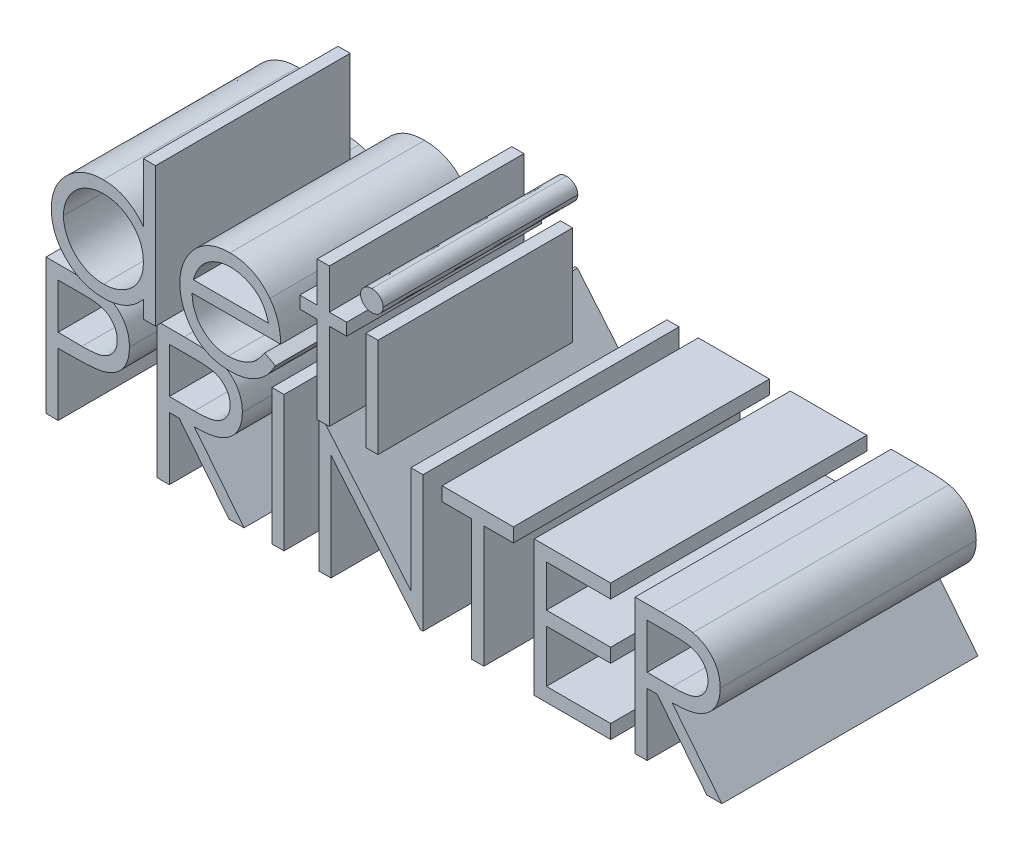
from build123d import *

# Parameters (mm, degrees)
BOSS_EXTRUDE1_DEPTH      = 50
BOSS_EXTRUDE1_2_DEPTH    = 50
SKETCH1_W                = 2.374465812
SKETCH1_H                = 26.458333333
BOSS_EXTRUDE1_3_DEPTH    = 50
BOSS_EXTRUDE1_4_DEPTH    = 50
BOSS_EXTRUDE1_5_DEPTH    = 50
BOSS_EXTRUDE1_6_DEPTH    = 50
BOSS_EXTRUDE1_7_DEPTH    = 50
BOSS_EXTRUDE2_DEPTH      = 1
BOSS_EXTRUDE2_DEPTH_BACK = 37
SKETCH2_W                = 2.374465812
SKETCH2_H                = 19.334935898


with BuildPart() as part:
    # Sketch1 → Boss-Extrude1 (new body)
    with BuildSketch(Plane.XY):
        with BuildLine():
            Line((3.392094017, 26.458333333), (8.580937834, 26.458333333))
            add(Edge.make_bspline(
                [(8.580937834, 26.458333333), (8.937829803, 26.457941022), (9.621650665, 26.457189337), (10.602234717, 26.434399295), (11.492820189, 26.40395942), (12.291486759, 26.361762965), (13.000691786, 26.311895884), (13.617226134, 26.241954872), (14.145935875, 26.168927638), (14.462728677, 26.094682482), (14.607204861, 26.060822316)],
                knots=[0, 0, 0, 0, 1.415646017, 2.712440637, 3.8905458, 4.950247383, 5.884950622, 6.709939814, 7.411656543, 8, 8, 8, 8], degree=3))
            add(Edge.make_bspline(
                [(14.607204861, 26.060822316), (14.790096456, 26.010763528), (15.151570034, 25.911825526), (15.672429109, 25.713662259), (16.167984965, 25.478695892), (16.639937818, 25.210907775), (17.082488088, 24.89880857), (17.502238517, 24.555049674), (17.895484797, 24.171694363), (18.260015557, 23.753042342), (18.594787539, 23.306121708), (18.883029783, 22.824260803), (19.124384416, 22.315570593), (19.331388909, 21.780404906), (19.48037544, 21.214269722), (19.592610931, 20.621098742), (19.663849069, 20.000955548), (19.670672006, 19.577169645), (19.674145299, 19.361436632)],
                knots=[0, 0, 0, 0, 0.999701418, 1.975846123, 2.934577507, 3.890451536, 4.834027766, 5.787354733, 6.749476667, 7.726910423, 8.712836071, 9.690891519, 10.682875813, 11.679750201, 12.712814741, 13.765529915, 14.8625177, 16, 16, 16, 16], degree=3))
            add(Edge.make_bspline(
                [(19.674145299, 19.361436632), (19.670959529, 19.143890343), (19.664726354, 18.718246336), (19.58991515, 18.095547282), (19.489145249, 17.500473738), (19.334197294, 16.934345154), (19.131256789, 16.400523556), (18.893191865, 15.890851147), (18.606054463, 15.413998865), (18.276120334, 14.968235536), (17.9090934, 14.553142747), (17.506526546, 14.171728527), (17.07004499, 13.826225492), (16.601035894, 13.515859085), (16.094926918, 13.247826495), (15.559393971, 13.007756393), (14.989782216, 12.806135875), (14.59560964, 12.700075291), (14.395198985, 12.646150507)],
                knots=[0, 0, 0, 0, 1.121902311, 2.195077645, 3.232258892, 4.234102512, 5.217864754, 6.176164875, 7.132989551, 8.084763148, 9.034132444, 9.988522005, 10.94243251, 11.903244335, 12.886203696, 13.894208494, 14.929344452, 16, 16, 16, 16], degree=3))
            add(Edge.make_bspline(
                [(14.395198985, 12.646150507), (14.229438782, 12.610900591), (13.866165658, 12.533648349), (13.267884366, 12.447405848), (12.571309127, 12.373794224), (11.777390701, 12.318601101), (10.886841717, 12.271351292), (9.899180427, 12.233794867), (8.812468058, 12.213158472), (8.054465201, 12.212094146), (7.658712273, 12.211538462)],
                knots=[0, 0, 0, 0, 0.601384939, 1.31797006, 2.144135048, 3.087295005, 4.142315834, 5.309527816, 6.595305764, 8, 8, 8, 8], degree=3))
            Line((7.658712273, 12.211538462), (5.766559829, 12.211538462))
            Line((5.766559829, 12.211538462), (5.766559829, 0))
            Line((5.766559829, 0), (3.392094017, 0))
            Line((3.392094017, 0), (3.392094017, 26.458333333))
        make_face()
        with BuildLine():
            Line((5.766559829, 23.74465812), (5.766559829, 14.925213675))
            Line((5.766559829, 14.925213675), (10.398888221, 14.866912059))
            add(Edge.make_bspline(
                [(10.398888221, 14.866912059), (10.625068613, 14.866795162), (11.061705196, 14.866569494), (11.692443312, 14.896695886), (12.277620662, 14.931473722), (12.815439774, 14.982394096), (13.306143088, 15.054370268), (13.750548812, 15.12703043), (14.14521101, 15.23214835), (14.607091881, 15.373685837), (15.121769567, 15.615081205), (15.681684963, 15.965464302), (16.156200706, 16.412086323), (16.566821163, 16.914249095), (16.892681074, 17.472891324), (17.131229349, 18.070614833), (17.27139167, 18.701289648), (17.29018611, 19.132848793), (17.299679487, 19.350836338)],
                knots=[0, 0, 0, 0, 1.160613943, 2.240541288, 3.23993089, 4.169200891, 5.011653406, 5.7853311, 6.478053781, 7.106038997, 8.262395093, 9.384106736, 10.481365981, 11.59014053, 12.70357646, 13.786202915, 14.881775077, 16, 16, 16, 16], degree=3))
            add(Edge.make_bspline(
                [(17.299679487, 19.350836338), (17.290134481, 19.563550101), (17.27116019, 19.986398733), (17.130130748, 20.606119126), (16.893144864, 21.197543796), (16.564633703, 21.749185572), (16.165935875, 22.249541412), (15.702542031, 22.684192313), (15.175542972, 23.033606375), (14.685321226, 23.259131778), (14.249883689, 23.396830587), (13.871665897, 23.493175511), (13.444623298, 23.570098249), (12.968616869, 23.632384967), (12.447336042, 23.685705775), (11.876302352, 23.721885484), (11.257678977, 23.743063159), (10.828218114, 23.744113594), (10.60559395, 23.74465812)],
                knots=[0, 0, 0, 0, 1.120700087, 2.227813068, 3.331159281, 4.466773991, 5.599788987, 6.693661531, 7.80175334, 8.91857717, 9.525282508, 10.207424825, 10.974604443, 11.810962634, 12.737642355, 13.736264703, 14.826523623, 16, 16, 16, 16], degree=3))
            Line((10.60559395, 23.74465812), (5.766559829, 23.74465812))
        make_face(mode=Mode.SUBTRACT)
    extrude(amount=BOSS_EXTRUDE1_DEPTH)


with BuildPart() as body_2:
    # Sketch1 → Boss-Extrude1 2 (new body)
    with BuildSketch(Plane.XY):
        with BuildLine():
            Line((25.101495726, 26.458333333), (30.396342481, 26.458333333))
            add(Edge.make_bspline(
                [(30.396342481, 26.458333333), (30.749683155, 26.457157177), (31.42813639, 26.454898828), (32.400089088, 26.442306453), (33.28324631, 26.406214598), (34.077146285, 26.375155663), (34.781774451, 26.318520154), (35.39929147, 26.264389072), (35.926853231, 26.19352866), (36.24621175, 26.127719808), (36.390808627, 26.097923344)],
                knots=[0, 0, 0, 0, 1.410062039, 2.707475311, 3.878576406, 4.937260626, 5.877586885, 6.699081471, 7.410979367, 8, 8, 8, 8], degree=3))
            add(Edge.make_bspline(
                [(36.390808627, 26.097923344), (36.584382512, 26.050096011), (36.967400825, 25.955461631), (37.518868586, 25.755439648), (38.044363773, 25.523969867), (38.541703517, 25.252101267), (39.0083967, 24.93781573), (39.449255359, 24.586538852), (39.866279993, 24.200192713), (40.242605412, 23.769036471), (40.597442291, 23.316700951), (40.896713455, 22.827571361), (41.154693391, 22.316082433), (41.360089561, 21.77703231), (41.525476623, 21.215648678), (41.642091647, 20.626846464), (41.71202622, 20.013308141), (41.719146199, 19.594828711), (41.72275641, 19.38263722)],
                knots=[0, 0, 0, 0, 1.027469482, 2.033020251, 3.019912614, 3.986113645, 4.951240523, 5.91722682, 6.890402269, 7.87763091, 8.8651537, 9.85103654, 10.82876324, 11.815024772, 12.821070561, 13.842952187, 14.906261191, 16, 16, 16, 16], degree=3))
            add(Edge.make_bspline(
                [(41.72275641, 19.38263722), (41.711651484, 19.030098036), (41.689982897, 18.342202779), (41.487953839, 17.343885401), (41.157024196, 16.412632844), (40.701008857, 15.549617665), (40.120290201, 14.771662191), (39.422358744, 14.088353392), (38.606825134, 13.516551672), (37.847627329, 13.120033446), (37.176990224, 12.866087053), (36.624893157, 12.687407436), (36.022648744, 12.549355674), (35.376027226, 12.425680869), (34.682337688, 12.332307941), (33.943242747, 12.263919994), (33.158215291, 12.221178079), (32.618925898, 12.214812923), (32.341496394, 12.211538462)],
                knots=[0, 0, 0, 0, 1.260483769, 2.459530307, 3.627416485, 4.787058657, 5.939039949, 7.08810263, 8.267026773, 9.491475466, 10.141966685, 10.831826277, 11.566392101, 12.351337768, 13.187381173, 14.07005841, 15.007169909, 16, 16, 16, 16], degree=3))
            Line((32.341496394, 12.211538462), (42.061965812, 0))
            Line((42.061965812, 0), (39.125684428, 0))
            Line((39.125684428, 0), (29.405215011, 12.211538462))
            Line((29.405215011, 12.211538462), (27.475961538, 12.211538462))
            Line((27.475961538, 12.211538462), (27.475961538, 0))
            Line((27.475961538, 0), (25.101495726, 0))
            Line((25.101495726, 0), (25.101495726, 26.458333333))
        make_face()
        with BuildLine():
            Line((27.475961538, 23.74465812), (27.475961538, 14.925213675))
            Line((27.475961538, 14.925213675), (32.320295807, 14.888112647))
            add(Edge.make_bspline(
                [(32.320295807, 14.888112647), (32.546477053, 14.888012584), (32.984880729, 14.887818634), (33.619129802, 14.91800968), (34.209680647, 14.952355003), (34.754274428, 15.004888746), (35.253154432, 15.072592383), (35.706071306, 15.15728161), (36.113764377, 15.255948988), (36.589247375, 15.408663659), (37.120202106, 15.650613916), (37.697231595, 16.002626912), (38.188618315, 16.445381563), (38.603771202, 16.951668999), (38.93736869, 17.508323975), (39.172561006, 18.108673909), (39.321804468, 18.737562775), (39.339407163, 19.169802043), (39.348290598, 19.387937366)],
                knots=[0, 0, 0, 0, 1.146690395, 2.22261258, 3.21895312, 4.145990853, 4.996080663, 5.770904154, 6.481378293, 7.121626537, 8.300444488, 9.431385265, 10.535395872, 11.636531494, 12.74115979, 13.810798291, 14.895190096, 16, 16, 16, 16], degree=3))
            add(Edge.make_bspline(
                [(39.348290598, 19.387937366), (39.339203135, 19.600712061), (39.3211951, 20.022353865), (39.174171671, 20.639633663), (38.925543609, 21.222223107), (38.590488597, 21.76775225), (38.182280699, 22.26294442), (37.703628186, 22.686634208), (37.167618675, 23.036258137), (36.666639973, 23.25967518), (36.218857534, 23.396652642), (35.830073794, 23.493045369), (35.390778695, 23.570488676), (34.898839216, 23.632537707), (34.356355459, 23.685869726), (33.760584466, 23.72179091), (33.115479044, 23.743062383), (32.668356409, 23.744113829), (32.436899038, 23.74465812)],
                knots=[0, 0, 0, 0, 1.101028733, 2.181837193, 3.264309656, 4.369019818, 5.486613113, 6.575447106, 7.666700264, 8.788928104, 9.402425223, 10.0903467, 10.862060571, 11.710948788, 12.657782767, 13.684531032, 14.801375019, 16, 16, 16, 16], degree=3))
            Line((32.436899038, 23.74465812), (27.475961538, 23.74465812))
        make_face(mode=Mode.SUBTRACT)
    extrude(amount=BOSS_EXTRUDE1_2_DEPTH)

    # Sketch2 → Boss-Extrude2 (add, two sides: drawn at the far end of the back side and taken through both)
    # profile 1 of 5: a face of its own
    with BuildSketch(Plane.XY.offset(50).offset(-BOSS_EXTRUDE2_DEPTH_BACK)):
        with BuildLine():
            Line((25.77991453, 53.59508547), (25.77991453, 26.458333333))
            Line((25.77991453, 26.458333333), (23.405448718, 26.458333333))
            Line((23.405448718, 26.458333333), (23.405448718, 29.802726028))
            add(Edge.make_bspline(
                [(23.405448718, 29.802726028), (23.137699527, 29.500045764), (22.615183614, 28.909361424), (21.742503734, 28.13766881), (20.817458579, 27.499808879), (19.844537878, 26.984627969), (18.824620205, 26.5976404), (17.75996645, 26.322578364), (16.650142321, 26.14573211), (15.892282258, 26.128072897), (15.508229834, 26.119123932)],
                knots=[0, 0, 0, 0, 1.074387032, 2.096679803, 3.090159297, 4.057316773, 5.018401886, 5.985159533, 6.978961417, 8, 8, 8, 8], degree=3))
            add(Edge.make_bspline(
                [(15.508229834, 26.119123932), (15.166781612, 26.128394722), (14.493430599, 26.146677131), (13.50291317, 26.288511212), (12.549715809, 26.516284364), (11.632937789, 26.833035135), (10.758511451, 27.25319968), (9.918950006, 27.756219829), (9.11860287, 28.355242771), (8.369669213, 29.040045128), (7.679998734, 29.783864376), (7.074773637, 30.577202736), (6.570152141, 31.416629677), (6.148178911, 32.291517209), (5.823147022, 33.208600232), (5.59656062, 34.164707394), (5.454891767, 35.158708224), (5.436616915, 35.83558438), (5.427350427, 36.178802751)],
                knots=[0, 0, 0, 0, 1.033919861, 2.038935746, 3.024066025, 3.998881131, 4.97069526, 5.957263378, 6.95902576, 7.993208707, 9.027059324, 10.027763471, 11.009749337, 11.988697705, 12.965288445, 13.950418724, 14.960734635, 16, 16, 16, 16], degree=3))
            add(Edge.make_bspline(
                [(5.427350427, 36.178802751), (5.436822294, 36.514927177), (5.455547664, 37.179427034), (5.595045219, 38.15671243), (5.829624868, 39.098011186), (6.158825859, 40.00029284), (6.580964447, 40.864649172), (7.094468439, 41.691691504), (7.699374917, 42.483698259), (8.396759184, 43.222046223), (9.152218459, 43.904071105), (9.960397556, 44.496806151), (10.801192599, 45.008713282), (11.687645119, 45.414308013), (12.606634542, 45.742460173), (13.566342138, 45.96949511), (14.562774905, 46.103278431), (15.239280411, 46.122651708), (15.582431891, 46.132478632)],
                knots=[0, 0, 0, 0, 1.020392517, 2.01726096, 2.990465484, 3.961182959, 4.928053699, 5.906110375, 6.912531644, 7.948652711, 8.985773172, 9.998621852, 10.987621588, 11.969261332, 12.953316658, 13.946091881, 14.958173133, 16, 16, 16, 16], degree=3))
            add(Edge.make_bspline(
                [(15.582431891, 46.132478632), (15.977166092, 46.120632133), (16.751985462, 46.09737877), (17.885146905, 45.903050877), (18.956993722, 45.576760074), (19.973696663, 45.130058126), (20.92919447, 44.549481018), (21.830491098, 43.84832424), (22.661912646, 43.006744028), (23.153824638, 42.374680348), (23.405448718, 42.051365518)],
                knots=[0, 0, 0, 0, 1.031072012, 2.023879775, 2.993683497, 3.952812103, 4.918022106, 5.908088563, 6.929940113, 8, 8, 8, 8], degree=3))
            Line((23.405448718, 42.051365518), (23.405448718, 53.59508547))
            Line((23.405448718, 53.59508547), (25.77991453, 53.59508547))
        make_face()
        with BuildLine():
            add(Edge.make_bspline(
                [(15.614232772, 43.758012821), (15.267142242, 43.745663297), (14.582040742, 43.721287302), (13.576291441, 43.530987666), (12.613862656, 43.214360078), (11.699567928, 42.781336182), (10.847849862, 42.236833233), (10.08665366, 41.578237061), (9.409753477, 40.823516776), (8.84045886, 39.976078203), (8.376375937, 39.067589062), (8.050053731, 38.117928132), (7.834839778, 37.144223837), (7.812852747, 36.483803534), (7.801816239, 36.152302017)],
                knots=[0, 0, 0, 0, 1.031046209, 2.035121221, 3.029706178, 4.034933723, 5.034054252, 6.02443088, 7.017295772, 8.038157696, 9.050218397, 10.03989886, 11.016116709, 12, 12, 12, 12], degree=3))
            add(Edge.make_bspline(
                [(7.801816239, 36.152302017), (7.815913945, 35.822781563), (7.844054097, 35.165032266), (8.046276608, 34.190000525), (8.38554708, 33.240115802), (8.848507912, 32.323440435), (9.428222277, 31.472358247), (10.100178162, 30.703251368), (10.870873741, 30.041871743), (11.72455192, 29.488230561), (12.636290744, 29.040990076), (13.595094869, 28.729797444), (14.582940467, 28.528882079), (15.2546218, 28.505413712), (15.593032185, 28.493589744)],
                knots=[0, 0, 0, 0, 0.979072187, 1.954306742, 2.945804271, 3.96968567, 4.997920485, 5.998718438, 6.996577872, 8.005894225, 9.015743152, 10.005417472, 10.995077863, 12, 12, 12, 12], degree=3))
            add(Edge.make_bspline(
                [(15.593032185, 28.493589744), (15.936586105, 28.50613828), (16.619880776, 28.531096076), (17.628613866, 28.722210402), (18.60753412, 29.037962628), (19.54330662, 29.475652455), (20.41504166, 30.018103896), (21.19743633, 30.6531575), (21.859015376, 31.391747047), (22.419876175, 32.2034619), (22.859654622, 33.09330854), (23.179997451, 34.040775339), (23.369393048, 35.045895281), (23.393263981, 35.7327833), (23.405448718, 36.083400107)],
                knots=[0, 0, 0, 0, 1.01762866, 2.023962475, 3.030623092, 4.058876274, 5.077231937, 6.066672613, 7.034107872, 8.005628644, 8.981990164, 9.965428785, 10.961468474, 12, 12, 12, 12], degree=3))
            add(Edge.make_bspline(
                [(23.405448718, 36.083400107), (23.398194173, 36.350537278), (23.383914932, 36.876347768), (23.274826698, 37.648383169), (23.101298385, 38.387203598), (22.856776743, 39.09358583), (22.535562867, 39.76362434), (22.14815416, 40.402130146), (21.687737963, 41.005782399), (21.161725915, 41.566268709), (20.585953253, 42.077492561), (19.976696904, 42.533817476), (19.326738519, 42.908684984), (18.647008538, 43.218937453), (17.936327617, 43.465825074), (17.188912812, 43.630529664), (16.412708566, 43.743622567), (15.883193742, 43.753165565), (15.614232772, 43.758012821)],
                knots=[0, 0, 0, 0, 1.050140795, 2.067009409, 3.05949893, 4.030605086, 5.00011959, 5.97591094, 6.962425594, 7.979863591, 8.993523472, 9.986985069, 10.967611495, 11.937549037, 12.921786183, 13.919465291, 14.943216303, 16, 16, 16, 16], degree=3))
        make_face(mode=Mode.SUBTRACT)
    # profile 2 of 5: a face of its own
    with BuildSketch(Plane.XY.offset(50).offset(-BOSS_EXTRUDE2_DEPTH_BACK)):
        with BuildLine():
            Line((47.075904781, 32.564102564), (49.185363248, 31.456371862))
            add(Edge.make_bspline(
                [(49.185363248, 31.456371862), (49.017265177, 31.15819906), (48.690212898, 30.578072866), (48.127778673, 29.781058206), (47.538195744, 29.06405464), (46.894850271, 28.446217373), (46.216990198, 27.907590831), (45.500856439, 27.436346561), (44.742720733, 27.034795842), (43.942547219, 26.696488042), (43.093616088, 26.436368652), (42.193870101, 26.252640315), (41.241585582, 26.139071558), (40.588849579, 26.125879125), (40.254615718, 26.119123932)],
                knots=[0, 0, 0, 0, 1.120438281, 2.179929193, 3.190490725, 4.156257408, 5.095198341, 6.022838206, 6.959905092, 7.901321166, 8.864066838, 9.862729781, 10.905609505, 12, 12, 12, 12], degree=3))
            add(Edge.make_bspline(
                [(40.254615718, 26.119123932), (39.883125769, 26.127796031), (39.1584565, 26.144712784), (38.103602459, 26.290554628), (37.110436617, 26.528470673), (36.179014812, 26.860829231), (35.311618022, 27.294952455), (34.506522274, 27.823812823), (33.759493716, 28.444693558), (33.094072611, 29.162972625), (32.495026592, 29.931639802), (31.966420691, 30.732615833), (31.52451035, 31.563885447), (31.165035261, 32.42015667), (30.874712769, 33.296032532), (30.672369235, 34.199482317), (30.555727688, 35.128060841), (30.537853605, 35.756237129), (30.528846154, 36.072799813)],
                knots=[0, 0, 0, 0, 1.145258523, 2.234067595, 3.276747158, 4.290159414, 5.277019952, 6.260822364, 7.254936242, 8.264827045, 9.274100331, 10.257902744, 11.220704747, 12.172965371, 13.118907548, 14.062713208, 15.023725156, 16, 16, 16, 16], degree=3))
            add(Edge.make_bspline(
                [(30.528846154, 36.072799813), (30.536852758, 36.369850019), (30.55272079, 36.9585643), (30.652739242, 37.829916928), (30.829997172, 38.676798682), (31.073234859, 39.499913259), (31.387342494, 40.297882486), (31.771609865, 41.071192015), (32.226635578, 41.819018965), (32.577946862, 42.29075694), (32.754907853, 42.528378739)],
                knots=[0, 0, 0, 0, 1.024358464, 2.0301432, 3.019427413, 4.004406732, 4.986367066, 5.972626655, 6.978780325, 8, 8, 8, 8], degree=3))
            add(Edge.make_bspline(
                [(32.754907853, 42.528378739), (32.994602835, 42.814649364), (33.466399872, 43.378122287), (34.264355654, 44.118489393), (35.12841071, 44.738701265), (36.047736693, 45.25280283), (37.033018371, 45.643430995), (38.071011226, 45.934529979), (39.173534408, 46.097649467), (39.927258399, 46.120689638), (40.312917334, 46.132478632)],
                knots=[0, 0, 0, 0, 1.030682036, 2.02871468, 2.997146059, 3.962720338, 4.930598197, 5.918074684, 6.934738563, 8, 8, 8, 8], degree=3))
            add(Edge.make_bspline(
                [(40.312917334, 46.132478632), (40.709396255, 46.122242668), (41.487197519, 46.102162038), (42.621368911, 45.915998684), (43.694524327, 45.620779968), (44.70623433, 45.203843576), (45.656601492, 44.66591125), (46.539448414, 43.9996009), (47.369873539, 43.225368931), (47.852991962, 42.629956574), (48.098833133, 42.326973157)],
                knots=[0, 0, 0, 0, 1.056321875, 2.072262726, 3.055038591, 4.01806755, 4.982017516, 5.957941055, 6.960871419, 8, 8, 8, 8], degree=3))
            add(Edge.make_bspline(
                [(48.098833133, 42.326973157), (48.26610225, 42.098648464), (48.599527091, 41.643518877), (49.017168859, 40.901391677), (49.379703928, 40.124948494), (49.66948286, 39.30163851), (49.904126708, 38.441216683), (50.073889564, 37.53753197), (50.173445609, 36.590853474), (50.193014928, 35.945825346), (50.202991453, 35.616987179)],
                knots=[0, 0, 0, 0, 0.94817472, 1.890038105, 2.849395472, 3.817997239, 4.812318967, 5.836947057, 6.897266129, 8, 8, 8, 8], degree=3))
            Line((50.202991453, 35.616987179), (32.903311966, 35.616987179))
            add(Edge.make_bspline(
                [(32.903311966, 35.616987179), (32.914950657, 35.362227718), (32.937837675, 34.861253511), (33.044541435, 34.128200567), (33.212731571, 33.429902088), (33.449110794, 32.771595759), (33.735366112, 32.144683485), (34.086020043, 31.553815706), (34.504360719, 31.001683734), (34.970977613, 30.483348825), (35.490370536, 30.021758547), (36.036793684, 29.608617144), (36.61807242, 29.262348645), (37.229623408, 28.981286383), (37.870457736, 28.761256493), (38.540777306, 28.61106523), (39.239263067, 28.510469839), (39.715405223, 28.499284274), (39.957807492, 28.493589744)],
                knots=[0, 0, 0, 0, 1.094153842, 2.151609401, 3.174256925, 4.172055639, 5.149267565, 6.128595816, 7.11444997, 8.118368179, 9.117203808, 10.09244225, 11.054858984, 12.015122123, 12.976791628, 13.957293641, 14.960065497, 16, 16, 16, 16], degree=3))
            add(Edge.make_bspline(
                [(39.957807492, 28.493589744), (40.194807239, 28.498186362), (40.6650602, 28.507306936), (41.365380967, 28.595994596), (42.054352394, 28.739400846), (42.729122922, 28.935116842), (43.375997769, 29.173822808), (43.975056392, 29.461862267), (44.525996117, 29.780494281), (45.040927948, 30.144936468), (45.540393195, 30.591010262), (46.035863182, 31.147661248), (46.567121216, 31.806001488), (46.89966159, 32.301495511), (47.075904781, 32.564102564)],
                knots=[0, 0, 0, 0, 0.99110716, 1.966546729, 2.947904876, 3.932708344, 4.903319531, 5.828989031, 6.710028674, 7.56322171, 8.463672341, 9.504779593, 10.677557249, 12, 12, 12, 12], degree=3))
        make_face()
        with BuildLine():
            add(Edge.make_bspline(
                [(47.828525641, 37.991452991), (47.741616634, 38.306404477), (47.574344772, 38.912584704), (47.224819874, 39.752000959), (46.831183822, 40.498034497), (46.365352876, 41.144975771), (45.837556558, 41.719526137), (45.227917379, 42.221619013), (44.544265089, 42.670786649), (43.79013349, 43.049915662), (42.991531901, 43.372630666), (42.155401759, 43.58902291), (41.302250624, 43.737261712), (40.725199769, 43.751066222), (40.434820713, 43.758012821)],
                knots=[0, 0, 0, 0, 1.154881502, 2.222775134, 3.210006277, 4.132804581, 5.035138423, 5.962687519, 6.919655026, 7.923214229, 8.944639381, 9.960483929, 10.97369054, 12, 12, 12, 12], degree=3))
            add(Edge.make_bspline(
                [(40.434820713, 43.758012821), (40.197833886, 43.753388875), (39.729360754, 43.744248307), (39.039168155, 43.657539591), (38.376351383, 43.514212192), (37.736019745, 43.317929484), (37.126564371, 43.05630493), (36.535449158, 42.749515062), (35.977704496, 42.37500428), (35.628898275, 42.089565318), (35.452682626, 41.94536258)],
                knots=[0, 0, 0, 0, 1.04873581, 2.073130211, 3.073294108, 4.04793562, 5.032784715, 6.005352987, 6.992311501, 8, 8, 8, 8], degree=3))
            add(Edge.make_bspline(
                [(35.452682626, 41.94536258), (35.326489363, 41.831256742), (35.071104956, 41.600334335), (34.729864109, 41.202482595), (34.403137916, 40.773467809), (34.105794232, 40.296876689), (33.833064858, 39.778136276), (33.577855507, 39.22162201), (33.348148701, 38.623110846), (33.21891025, 38.206033478), (33.15241887, 37.991452991)],
                knots=[0, 0, 0, 0, 0.879870761, 1.780643979, 2.707998968, 3.669668524, 4.684282772, 5.740141944, 6.837334558, 8, 8, 8, 8], degree=3))
            Line((33.15241887, 37.991452991), (47.828525641, 37.991452991))
        make_face(mode=Mode.SUBTRACT)
    # profile 3 of 5: a face of its own
    with BuildSketch(Plane.XY.offset(50).offset(-BOSS_EXTRUDE2_DEPTH_BACK)):
        Polygon((57.326388889, 53.59508547), (59.700854701, 53.59508547), (59.700854701, 45.793269231), (63.092948718, 45.793269231), (63.092948718, 43.418803419), (59.700854701, 43.418803419), (59.700854701, 26.458333333), (57.326388889, 26.458333333), (57.326388889, 43.418803419), (53.934294872, 43.418803419), (53.934294872, 45.793269231), (57.326388889, 45.793269231), align=None)
    # profile 4 of 5: a face of its own
    with BuildSketch(Plane.XY.offset(50).offset(-BOSS_EXTRUDE2_DEPTH_BACK)):
        with BuildLine():
            add(Edge.make_bspline(
                [(68.000884749, 53.934294872), (68.148229815, 53.92745991), (68.436759753, 53.914075743), (68.853994574, 53.799462196), (69.233913653, 53.605184812), (69.570900086, 53.344534843), (69.860066135, 53.03800036), (70.062515552, 52.680729945), (70.192633071, 52.294750949), (70.208345959, 52.025517834), (70.216346154, 51.888438168)],
                knots=[0, 0, 0, 0, 1.055194115, 2.066272739, 3.074728998, 4.095836921, 5.109056067, 6.073838105, 7.019297344, 8, 8, 8, 8], degree=3))
            add(Edge.make_bspline(
                [(70.216346154, 51.888438168), (70.208165541, 51.754916921), (70.191993437, 51.490961217), (70.062616056, 51.11167366), (69.858340805, 50.759367469), (69.571085511, 50.453428172), (69.23386452, 50.192922295), (68.854007627, 49.998606709), (68.436756319, 49.88400329), (68.148228654, 49.870617726), (68.000884749, 49.863782051)],
                knots=[0, 0, 0, 0, 0.96129708, 1.900370562, 2.859976407, 3.87933698, 4.906634145, 5.921202961, 6.938410037, 8, 8, 8, 8], degree=3))
            add(Edge.make_bspline(
                [(68.000884749, 49.863782051), (67.855225764, 49.870356722), (67.571719581, 49.88315346), (67.160732142, 50.000855379), (66.78405249, 50.192988789), (66.446408833, 50.45172245), (66.164966302, 50.761246376), (65.960115866, 51.111458657), (65.831037285, 51.491015956), (65.814824914, 51.754935309), (65.806623932, 51.888438168)],
                knots=[0, 0, 0, 0, 1.054934014, 2.053291228, 3.073705704, 4.106921865, 5.123545215, 6.088680038, 7.033164197, 8, 8, 8, 8], degree=3))
            add(Edge.make_bspline(
                [(65.806623932, 51.888438168), (65.814645241, 52.025498757), (65.830399599, 52.294694402), (65.96021262, 52.68094852), (66.163259976, 53.036106302), (66.446595189, 53.346239541), (66.784002894, 53.605118721), (67.160744956, 53.797213641), (67.571716195, 53.914925551), (67.855224615, 53.92772091), (68.000884749, 53.934294872)],
                knots=[0, 0, 0, 0, 0.98631895, 1.937192651, 2.907499808, 3.917963147, 4.944918757, 5.95915025, 6.951458133, 8, 8, 8, 8], degree=3))
        make_face()
    # profile 5 of 5: a face of its own
    with BuildSketch(Plane.XY.offset(50).offset(-BOSS_EXTRUDE2_DEPTH_BACK)):
        with Locations((68.011485043, 36.125801282)):
            Rectangle(SKETCH2_W, SKETCH2_H)
    extrude(amount=BOSS_EXTRUDE2_DEPTH + BOSS_EXTRUDE2_DEPTH_BACK)


with BuildPart() as body_3:
    # Sketch1 → Boss-Extrude1 3 (new body)
    with BuildSketch(Plane.XY):
        with Locations((48.676549145, 13.229166667)):
            Rectangle(SKETCH1_W, SKETCH1_H)
    extrude(amount=BOSS_EXTRUDE1_3_DEPTH)


with BuildPart() as body_4:
    # Sketch1 → Boss-Extrude1 4 (new body)
    with BuildSketch(Plane.XY):
        Polygon((56.647970085, 0), (56.647970085, 26.458333333), (57.146183894, 26.458333333), (74.626068376, 5.634056157), (74.626068376, 26.458333333), (77.000534188, 26.458333333), (77.000534188, 0), (76.459919204, 0), (59.022435897, 20.776575855), (59.022435897, 0), align=None)
    extrude(amount=BOSS_EXTRUDE1_4_DEPTH)


with BuildPart() as body_5:
    # Sketch1 → Boss-Extrude1 5 (new body)
    with BuildSketch(Plane.XY):
        Polygon((80.731837607, 23.74465812), (80.731837607, 26.458333333), (94.639423077, 26.458333333), (94.639423077, 23.74465812), (88.872863248, 23.74465812), (88.872863248, 0), (86.498397436, 0), (86.498397436, 23.74465812), align=None)
    extrude(amount=BOSS_EXTRUDE1_5_DEPTH)


with BuildPart() as body_6:
    # Sketch1 → Boss-Extrude1 6 (new body)
    with BuildSketch(Plane.XY):
        Polygon((98.709935897, 26.458333333), (113.635149573, 26.458333333), (113.635149573, 23.74465812), (101.084401709, 23.74465812), (101.084401709, 15.603632479), (113.635149573, 15.603632479), (113.635149573, 12.889957265), (101.084401709, 12.889957265), (101.084401709, 2.713675214), (113.635149573, 2.713675214), (113.635149573, 0), (98.709935897, 0), align=None)
    extrude(amount=BOSS_EXTRUDE1_6_DEPTH)


with BuildPart() as body_7:
    # Sketch1 → Boss-Extrude1 7 (new body)
    with BuildSketch(Plane.XY):
        with BuildLine():
            Line((118.384081197, 26.458333333), (123.678927951, 26.458333333))
            add(Edge.make_bspline(
                [(123.678927951, 26.458333333), (124.032268625, 26.457157177), (124.71072186, 26.454898828), (125.682674558, 26.442306453), (126.56583178, 26.406214598), (127.359731756, 26.375155663), (128.064359921, 26.318520154), (128.68187694, 26.264389072), (129.209438701, 26.19352866), (129.52879722, 26.127719808), (129.673394097, 26.097923344)],
                knots=[0, 0, 0, 0, 1.410062039, 2.707475311, 3.878576406, 4.937260626, 5.877586885, 6.699081471, 7.410979367, 8, 8, 8, 8], degree=3))
            add(Edge.make_bspline(
                [(129.673394097, 26.097923344), (129.866967982, 26.050096011), (130.249986295, 25.955461631), (130.801454056, 25.755439648), (131.326949243, 25.523969867), (131.824288987, 25.252101267), (132.29098217, 24.93781573), (132.731840829, 24.586538852), (133.148865463, 24.200192713), (133.525190882, 23.769036471), (133.880027761, 23.316700951), (134.179298925, 22.827571361), (134.437278861, 22.316082433), (134.642675031, 21.77703231), (134.808062093, 21.215648678), (134.924677117, 20.626846464), (134.99461169, 20.013308141), (135.001731669, 19.594828711), (135.00534188, 19.38263722)],
                knots=[0, 0, 0, 0, 1.027469482, 2.033020251, 3.019912614, 3.986113645, 4.951240523, 5.91722682, 6.890402269, 7.87763091, 8.8651537, 9.85103654, 10.82876324, 11.815024772, 12.821070561, 13.842952187, 14.906261191, 16, 16, 16, 16], degree=3))
            add(Edge.make_bspline(
                [(135.00534188, 19.38263722), (134.994236954, 19.030098036), (134.972568367, 18.342202779), (134.770539309, 17.343885401), (134.439609666, 16.412632844), (133.983594327, 15.549617665), (133.402875671, 14.771662191), (132.704944214, 14.088353392), (131.889410604, 13.516551672), (131.130212799, 13.120033446), (130.459575694, 12.866087053), (129.907478627, 12.687407436), (129.305234214, 12.549355674), (128.658612696, 12.425680869), (127.964923158, 12.332307941), (127.225828217, 12.263919994), (126.440800761, 12.221178079), (125.901511368, 12.214812923), (125.624081864, 12.211538462)],
                knots=[0, 0, 0, 0, 1.260483769, 2.459530307, 3.627416485, 4.787058657, 5.939039949, 7.08810263, 8.267026773, 9.491475466, 10.141966685, 10.831826277, 11.566392101, 12.351337768, 13.187381173, 14.07005841, 15.007169909, 16, 16, 16, 16], degree=3))
            Line((125.624081864, 12.211538462), (135.344551282, 0))
            Line((135.344551282, 0), (132.408269899, 0))
            Line((132.408269899, 0), (122.687800481, 12.211538462))
            Line((122.687800481, 12.211538462), (120.758547009, 12.211538462))
            Line((120.758547009, 12.211538462), (120.758547009, 0))
            Line((120.758547009, 0), (118.384081197, 0))
            Line((118.384081197, 0), (118.384081197, 26.458333333))
        make_face()
        with BuildLine():
            Line((120.758547009, 23.74465812), (120.758547009, 14.925213675))
            Line((120.758547009, 14.925213675), (125.602881277, 14.888112647))
            add(Edge.make_bspline(
                [(125.602881277, 14.888112647), (125.829062523, 14.888012584), (126.267466199, 14.887818634), (126.901715272, 14.91800968), (127.492266117, 14.952355003), (128.036859898, 15.004888746), (128.535739902, 15.072592383), (128.988656776, 15.15728161), (129.396349847, 15.255948988), (129.871832845, 15.408663659), (130.402787576, 15.650613916), (130.979817065, 16.002626912), (131.471203785, 16.445381563), (131.886356672, 16.951668999), (132.21995416, 17.508323975), (132.455146476, 18.108673909), (132.604389938, 18.737562775), (132.621992633, 19.169802043), (132.630876068, 19.387937366)],
                knots=[0, 0, 0, 0, 1.146690395, 2.22261258, 3.21895312, 4.145990853, 4.996080663, 5.770904154, 6.481378293, 7.121626537, 8.300444488, 9.431385265, 10.535395872, 11.636531494, 12.74115979, 13.810798291, 14.895190096, 16, 16, 16, 16], degree=3))
            add(Edge.make_bspline(
                [(132.630876068, 19.387937366), (132.621788605, 19.600712061), (132.60378057, 20.022353865), (132.456757141, 20.639633663), (132.208129079, 21.222223107), (131.873074067, 21.76775225), (131.464866169, 22.26294442), (130.986213656, 22.686634208), (130.450204145, 23.036258137), (129.949225444, 23.25967518), (129.501443004, 23.396652642), (129.112659264, 23.493045369), (128.673364165, 23.570488676), (128.181424686, 23.632537707), (127.63894093, 23.685869726), (127.043169936, 23.72179091), (126.398064514, 23.743062383), (125.950941879, 23.744113829), (125.719484509, 23.74465812)],
                knots=[0, 0, 0, 0, 1.101028733, 2.181837193, 3.264309656, 4.369019818, 5.486613113, 6.575447106, 7.666700264, 8.788928104, 9.402425223, 10.0903467, 10.862060571, 11.710948788, 12.657782767, 13.684531032, 14.801375019, 16, 16, 16, 16], degree=3))
            Line((125.719484509, 23.74465812), (120.758547009, 23.74465812))
        make_face(mode=Mode.SUBTRACT)
    extrude(amount=BOSS_EXTRUDE1_7_DEPTH)


with BuildPart() as boss_extrude2_piece_1:
    # of the separate pieces the step leaves, piece 1, a body of its own (boss_extrude2_pieces)
    add(body_2.part.solids().sort_by_distance((25.101495726, 26.458333333, 0))[0])


with BuildPart() as boss_extrude2_piece_2:
    # of the separate pieces the step leaves, piece 2, a body of its own (boss_extrude2_pieces)
    add(body_2.part.solids().sort_by_distance((47.075904781, 32.564102564, 50))[0])


with BuildPart() as boss_extrude2_piece_3:
    # of the separate pieces the step leaves, piece 3, a body of its own (boss_extrude2_pieces)
    add(body_2.part.solids().sort_by_distance((57.326388889, 53.59508547, 51))[0])


with BuildPart() as boss_extrude2_piece_4:
    # of the separate pieces the step leaves, piece 4, a body of its own (boss_extrude2_pieces)
    add(body_2.part.solids().sort_by_distance((66.824252137, 45.793269231, 51))[0])


with BuildPart() as boss_extrude2_piece_5:
    # of the separate pieces the step leaves, piece 5, a body of its own (boss_extrude2_pieces)
    add(body_2.part.solids().sort_by_distance((68.000884749, 53.934294872, 50))[0])


solid = Compound([part.part, body_3.part, body_4.part, body_5.part, body_6.part, body_7.part, boss_extrude2_piece_1.part, boss_extrude2_piece_2.part, boss_extrude2_piece_3.part, boss_extrude2_piece_4.part, boss_extrude2_piece_5.part])
